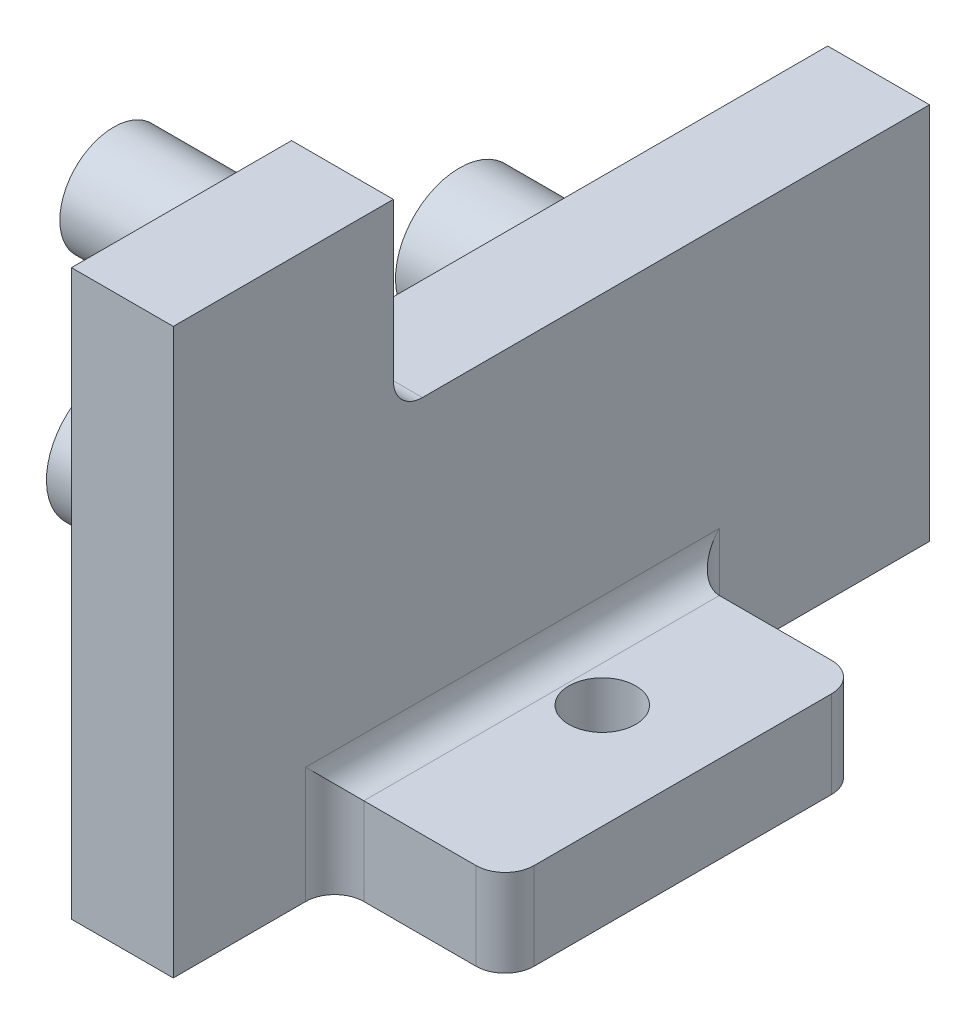
from build123d import *

# Parameters (mm, degrees)
SKETCH_1_W             = 3.5
SKETCH_1_H             = 13
EXTRUDE_1_DEPTH        = 26
SKETCH_3_R             = 2.2
EXTRUDE_3_DEPTH        = 6.5
HOLE_WIZARD_M2_1_D     = 1.6
HOLE_WIZARD_M2_1_DEPTH = 6
HOLE_WIZARD_M2_1_TIP   = 0.480688495
SKETCH_6_W             = 5.854472115
SKETCH_6_H             = 12.222775643
EXTRUDE_4_DEPTH        = 3
F_2_0MM_1_D            = 2.3
F_2_0MM_1_DEPTH        = 4.15
F_2_0MM_1_TIP          = 0.690989712
FILLET_2_R             = 1
FILLET_3_R             = 1
FILLET_4_R             = 1
FILLET_5_R             = 1
FILLET_6_R             = 1
SKETCH_9_W             = 7.566336663
SKETCH_9_H             = 6.401025682
EXTRUDE_5_DEPTH        = 3.5
SKETCH_10_R            = 1.85
EXTRUDE_6_DEPTH        = 3.7
FILLET_7_R             = 1


with BuildPart() as part:
    # 草图1 → 凸台-拉伸1 (new body)
    with BuildSketch(Plane.XY):
        with Locations((0.621335505, 0.911868233)):
            Rectangle(SKETCH_1_W, SKETCH_1_H)
    extrude(amount=EXTRUDE_1_DEPTH)

    # 草图3 → 凸台-拉伸3 (add)
    with BuildSketch(Plane.ZY.offset(1.128664495)):
        with Locations(Location((6.16, 1.411868233, 0), (0, 0, 90))):
            Circle(SKETCH_3_R)
        with Locations(Location((18.16, 1.411868233, 0), (0, 0, 90))):
            Circle(SKETCH_3_R)
    extrude(amount=EXTRUDE_3_DEPTH)

    # M2 螺纹孔1
    with Locations(Plane.XZ.offset(5.588131767)):
        with Locations((0.621335505, 9), (0.621335505, 18)):
            Hole(HOLE_WIZARD_M2_1_D / 2, depth=HOLE_WIZARD_M2_1_DEPTH)
            with Locations((0, 0, -(HOLE_WIZARD_M2_1_DEPTH + HOLE_WIZARD_M2_1_TIP / 2))):  # 118° drill point
                Cone(0, HOLE_WIZARD_M2_1_D / 2, HOLE_WIZARD_M2_1_TIP, mode=Mode.SUBTRACT)

    # 草图6 → 凸台-拉伸4 (add)
    with BuildSketch(Plane.XZ.offset(5.588131767)):
        with Locations((5.298571563, 14.336084675)):
            Rectangle(SKETCH_6_W, SKETCH_6_H)
    extrude(amount=-EXTRUDE_4_DEPTH)

    # Ø2.0mm 暗销孔1
    with Locations(Plane.XZ.offset(5.588131767)):
        with Locations((4.621335505, 13.5)):
            Hole(F_2_0MM_1_D / 2, depth=F_2_0MM_1_DEPTH)
            with Locations((0, 0, -(F_2_0MM_1_DEPTH + F_2_0MM_1_TIP / 2))):  # 118° drill point
                Cone(0, F_2_0MM_1_D / 2, F_2_0MM_1_TIP, mode=Mode.SUBTRACT)

    # 圆角2
    fillet_2_edges = [part.edges().sort_by_distance(p)[0] for p in [
        (2.371335505, -2.588131767, 14.336084675),
    ]]
    fillet(fillet_2_edges, radius=FILLET_2_R)

    # 圆角3
    fillet_3_edges = [part.edges().sort_by_distance(p)[0] for p in [
        (2.371335505, -3.588131767, 20.447472496),
    ]]
    fillet(fillet_3_edges, radius=FILLET_3_R)

    # 圆角4
    fillet_4_edges = [part.edges().sort_by_distance(p)[0] for p in [
        (2.371335505, -3.588131767, 8.224696853),
    ]]
    fillet(fillet_4_edges, radius=FILLET_4_R)

    # 圆角5
    fillet_5_edges = [part.edges().sort_by_distance(p)[0] for p in [
        (8.22580762, -4.088131767, 8.224696853),
    ]]
    fillet(fillet_5_edges, radius=FILLET_5_R)

    # 圆角6
    fillet_6_edges = [part.edges().sort_by_distance(p)[0] for p in [
        (8.22580762, -4.088131767, 20.447472496),
    ]]
    fillet(fillet_6_edges, radius=FILLET_6_R)

    # 草图9 → 凸台-拉伸5 (add)
    with BuildSketch(Plane.ZY.offset(1.128664495)):
        with Locations((22.216831668, 10.612381074)):
            Rectangle(SKETCH_9_W, SKETCH_9_H)
    extrude(amount=-EXTRUDE_5_DEPTH)

    # 草图10 → 凸台-拉伸6 (add)
    with BuildSketch(Plane.ZY.offset(1.128664495)):
        with Locations(Location((20.85, 11.722893915, 0), (0, 0, 90))):
            Circle(SKETCH_10_R)
    extrude(amount=EXTRUDE_6_DEPTH)

    # 圆角7
    fillet_7_edges = [part.edges().sort_by_distance(p)[0] for p in [
        (0.621335505, 7.411868233, 18.433663337),
    ]]
    fillet(fillet_7_edges, radius=FILLET_7_R)


solid = part.part
